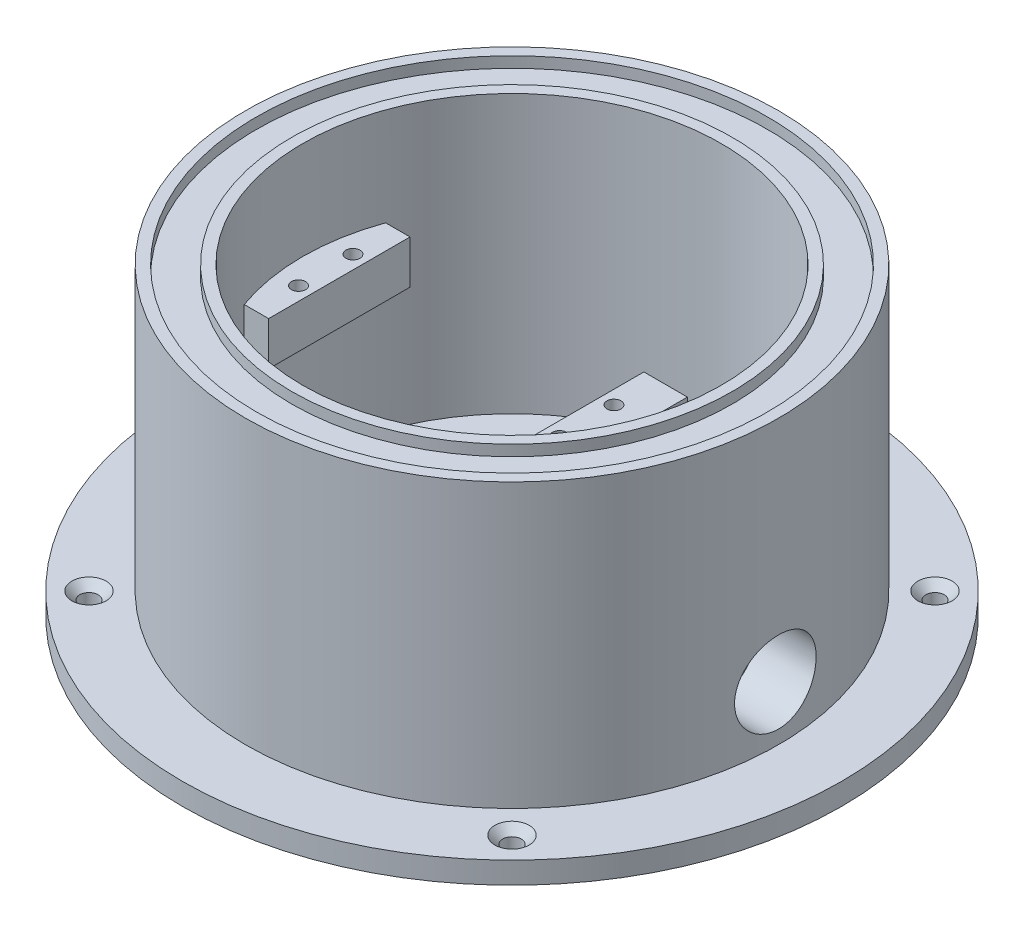
from build123d import *

# Parameters (mm, degrees)
SKETCH1_R                                    = 60.625
SKETCH1_R_2                                  = 45
BOSS_EXTRUDE1_DEPTH                          = 4
SKETCH2_R                                    = 49
SKETCH2_R_2                                  = 45
BOSS_EXTRUDE2_DEPTH                          = 52
SKETCH4_W                                    = 13.25
SKETCH4_H                                    = 8
SKETCH4_W_2                                  = 8
SKETCH4_H_2                                  = 38
BOSS_EXTRUDE4_DEPTH                          = 13
BOSS_EXTRUDE5_DEPTH                          = 4
BOSS_EXTRUDE6_REACH                          = 104.405
SKETCH18_R                                   = 45.113728165
SKETCH18_R_2                                 = 38.5
SKETCH7_R                                    = 1.3
CUT_EXTRUDE4_DEPTH                           = 7.2
SKETCH9_W                                    = 10
SKETCH9_H                                    = 24
CUT_EXTRUDE7_DEPTH                           = 8
SKETCH11_R                                   = 7.5
CUT_EXTRUDE8_DEPTH                           = 20
CUT_EXTRUDE9_DEPTH                           = 101.273532203
CSK_FOR_M3_COUNTERSUNK_FLAT_HEAD_SCR_2_COUNT = 2
CSK_FOR_M3_COUNTERSUNK_FLAT_HEAD_SCR_2_PITCH = 77.781745931
CSK_FOR_M3_COUNTERSUNK_FLAT_HEAD_SCR_3_COUNT = 2
CSK_FOR_M3_COUNTERSUNK_FLAT_HEAD_SCR_3_PITCH = 110
CSK_FOR_M3_COUNTERSUNK_FLAT_HEAD_SCR_4_COUNT = 2
CSK_FOR_M3_COUNTERSUNK_FLAT_HEAD_SCR_4_PITCH = 77.781745931
SKETCH20_R                                   = 38.708370422
BOSS_EXTRUDE7_DEPTH                          = 5
SKETCH21_R                                   = 47
SKETCH21_R_2                                 = 40.5
CUT_EXTRUDE10_DEPTH                          = 2


with BuildPart() as part:
    # Sketch1 → Boss-Extrude1 (new body)
    with BuildSketch(Plane(origin=(0, 0, 0), x_dir=(1, 0, 0), z_dir=(0, 1, 0))):
        with Locations(Location((0, 0, 0), (0, 0, 270))):
            Circle(SKETCH1_R)
        with Locations(Location((0, 0, 0), (0, 0, 270))):
            Circle(SKETCH1_R_2, mode=Mode.SUBTRACT)
    extrude(amount=BOSS_EXTRUDE1_DEPTH)

    # Sketch2 → Boss-Extrude2 (add)
    with BuildSketch(Plane(origin=(0, 4, 0), x_dir=(1, 0, 0), z_dir=(0, 1, 0))):
        with Locations(Location((0, 0, 0), (0, 0, 90))):
            Circle(SKETCH2_R)
        with Locations(Location((0, 0, 0), (0, 0, 270))):
            Circle(SKETCH2_R_2, mode=Mode.SUBTRACT)
    extrude(amount=BOSS_EXTRUDE2_DEPTH)

    # Sketch4 → Boss-Extrude4 (add, symmetric)
    with BuildSketch(Plane.XY):
        with Locations((-38.375, 34)):
            Rectangle(SKETCH4_W, SKETCH4_H)
        Polygon((-31.75, 30), (-45, 30), (-45, 16.75), align=None)
        with Locations((15.25, 19)):
            Rectangle(SKETCH4_W_2, SKETCH4_H_2)
    extrude(amount=BOSS_EXTRUDE4_DEPTH, both=True)


with BuildPart() as boss_extrude4_piece_1:
    # of the separate pieces the step leaves, piece 1, a body of its own (boss_extrude4_pieces)
    add(part.part.solids().sort_by_distance((0, 0, 60.625))[0])



with BuildPart() as boss_extrude4_piece_2:
    # of the separate pieces the step leaves, piece 2, a body of its own (boss_extrude4_pieces)
    add(part.part.solids().sort_by_distance((11.25, 38, -13))[0])


with BuildPart() as boss_extrude4_piece_1_1:
    add(boss_extrude4_piece_1.part)

    add(boss_extrude4_piece_2.part)  # Boss-Extrude5 merges Boss-Extrude4 piece 2
    # Sketch5 → Boss-Extrude5 (add)
    with BuildSketch(Plane.XZ):
        with BuildLine():
            Line((11.25, 13), (29.067400866, 34.352382842))
            ThreePointArc((29.067400866, 34.352382842), (45, 0), (29.067400866, -34.352382842))
            Line((29.067400866, -34.352382842), (11.25, -13))
            Line((11.25, -13), (11.25, 13))
        make_face()
    extrude(amount=-BOSS_EXTRUDE5_DEPTH)

    # Boss-Extrude6: up to this face of the body (flat: up to its plane)
    boss_extrude6_end = Plane(boss_extrude4_piece_1_1.part.faces().sort_by_distance((12.964733944, 0, 0))[0])
    # Sketch18 → Boss-Extrude6 (add, up to the picked face)
    with BuildSketch(Plane(origin=(0, 56, 0), x_dir=(1, 0, 0), z_dir=(0, 1, 0)), mode=Mode.PRIVATE) as boss_extrude6_sk1:
        Circle(SKETCH18_R)
        with Locations(Location((0, 0, 0), (0, 0, 270))):
            Circle(SKETCH18_R_2, mode=Mode.SUBTRACT)
    boss_extrude6_tool1 = split(extrude(boss_extrude6_sk1.sketch, amount=-BOSS_EXTRUDE6_REACH, mode=Mode.PRIVATE), bisect_by=boss_extrude6_end, keep=Keep.BOTH, mode=Mode.PRIVATE)
    add(boss_extrude6_tool1.solids().sort_by(Axis((-43.837719, 56, 0), (0, -1, 0)))[0])

    # Sketch7 → Cut-Extrude4 (cut)
    with BuildSketch(Plane(origin=(0, 38, 0), x_dir=(1, 0, 0), z_dir=(0, 1, 0))):
        with Locations(Location((-34.25, 5, 0), (0, 0, 180))):
            Circle(SKETCH7_R)
        with Locations(Location((-34.25, -5, 0), (0, 0, 180))):
            Circle(SKETCH7_R)
        with Locations(Location((13.75, 5, 0), (0, 0, 180))):
            Circle(SKETCH7_R)
        with Locations(Location((13.75, -5, 0), (0, 0, 180))):
            Circle(SKETCH7_R)
    extrude(amount=-CUT_EXTRUDE4_DEPTH, mode=Mode.SUBTRACT)

    # Sketch9 → Cut-Extrude7 (cut)
    with BuildSketch(Plane.ZY.offset(-11.25)):
        with Locations((0, 17)):
            Rectangle(SKETCH9_W, SKETCH9_H)
    extrude(amount=-CUT_EXTRUDE7_DEPTH, mode=Mode.SUBTRACT)

    # Sketch11 → Cut-Extrude8 (cut)
    with BuildSketch(Plane(origin=(49, 0, 0), x_dir=(0, 0, -1), z_dir=(1, 0, 0))):
        with Locations((0, 14)):
            Circle(SKETCH11_R)
    extrude(amount=-CUT_EXTRUDE8_DEPTH, mode=Mode.SUBTRACT)

    # Sketch12 → Cut-Extrude9 (cut, through all)
    # profile 1 of 2: a face of its own
    with BuildSketch(Plane(origin=(0, 4, 0), x_dir=(1, 0, 0), z_dir=(0, 1, 0))):
        with BuildLine():
            Line((19.25, -13), (11.25, -13))
            Line((11.25, -13), (24.902812686, -29.361538112))
            ThreePointArc((24.902812686, -29.361538112), (38.5, 0), (24.902812686, 29.361538112))
            Line((24.902812686, 29.361538112), (11.25, 13))
            Line((11.25, 13), (19.25, 13))
            Line((19.25, 13), (19.25, -13))
        make_face()
        with BuildLine():
            Line((27.25, -13.699908759), (27.25, 13.699908759))
            ThreePointArc((27.25, 13.699908759), (30.5, 0), (27.25, -13.699908759))
        make_face(mode=Mode.SUBTRACT)
    # profile 2 of 2: a face of its own
    with BuildSketch(Plane(origin=(0, 4, 0), x_dir=(1, 0, 0), z_dir=(0, 1, 0))):
        with BuildLine():
            ThreePointArc((27.25, -13.699908759), (30.5, 0), (27.25, 13.699908759))
            Line((27.25, 13.699908759), (27.25, -13.699908759))
        make_face()
    extrude(amount=-CUT_EXTRUDE9_DEPTH, mode=Mode.SUBTRACT)


with BuildPart() as cut_extrude9_piece_1:
    # of the separate pieces the step leaves, piece 1, a body of its own (cut_extrude9_pieces)
    add(boss_extrude4_piece_1_1.part.solids().sort_by_distance((0, 0, 38.5))[0])

    # Sketch17 → CSK for M3 Countersunk Flat Head Screw1 (revolve, cut)
    with BuildSketch(Plane(origin=(-38.890872965, 4, -38.890872965), x_dir=(0, 0, 1), z_dir=(1, 0, 0))):
        Polygon((0, 0), (0, 4), (1.7, 4), (1.7, 1.45), (3.15, 0), align=None)
    csk_for_m3_countersunk_flat_head_screw1 = revolve(axis=Axis((-38.890872965, 10.35, -38.890872965), (0, -1, 0)), mode=Mode.SUBTRACT)

    # CSK for M3 Countersunk Flat Head Scr 2: CSK for M3 Countersunk Flat Head Screw1 ×2
    with Locations(*[(0, 0, i * CSK_FOR_M3_COUNTERSUNK_FLAT_HEAD_SCR_2_PITCH) for i in range(1, CSK_FOR_M3_COUNTERSUNK_FLAT_HEAD_SCR_2_COUNT)]):
        add(csk_for_m3_countersunk_flat_head_screw1, mode=Mode.SUBTRACT)

    # CSK for M3 Countersunk Flat Head Scr 3: CSK for M3 Countersunk Flat Head Screw1 ×2
    with Locations(*[Vector(0.7071067811865713, 0, 0.7071067811865237) * (i * CSK_FOR_M3_COUNTERSUNK_FLAT_HEAD_SCR_3_PITCH) for i in range(1, CSK_FOR_M3_COUNTERSUNK_FLAT_HEAD_SCR_3_COUNT)]):
        add(csk_for_m3_countersunk_flat_head_screw1, mode=Mode.SUBTRACT)

    # CSK for M3 Countersunk Flat Head Scr 4: CSK for M3 Countersunk Flat Head Screw1 ×2
    with Locations(*[(i * CSK_FOR_M3_COUNTERSUNK_FLAT_HEAD_SCR_4_PITCH, 0, 0) for i in range(1, CSK_FOR_M3_COUNTERSUNK_FLAT_HEAD_SCR_4_COUNT)]):
        add(csk_for_m3_countersunk_flat_head_screw1, mode=Mode.SUBTRACT)



with BuildPart() as cut_extrude9_piece_2:
    # of the separate pieces the step leaves, piece 2, a body of its own (cut_extrude9_pieces)
    add(boss_extrude4_piece_1_1.part.solids().sort_by_distance((11.25, 38, -13))[0])


with BuildPart() as cut_extrude9_piece_1_1:
    add(cut_extrude9_piece_1.part)

    add(cut_extrude9_piece_2.part)  # Boss-Extrude7 merges Cut-Extrude9 piece 2
    # Sketch20 → Boss-Extrude7 (add)
    with BuildSketch(Plane(origin=(0, 5, 0), x_dir=(1, 0, 0), z_dir=(0, 1, 0))):
        Circle(SKETCH20_R)
    extrude(amount=-BOSS_EXTRUDE7_DEPTH)

    # Sketch21 → Cut-Extrude10 (cut)
    with BuildSketch(Plane(origin=(0, 56, 0), x_dir=(1, 0, 0), z_dir=(0, 1, 0))):
        with Locations(Location((0, 0, 0), (0, 0, 270))):
            Circle(SKETCH21_R)
        with Locations(Location((0, 0, 0), (0, 0, 270))):
            Circle(SKETCH21_R_2, mode=Mode.SUBTRACT)
    extrude(amount=-CUT_EXTRUDE10_DEPTH, mode=Mode.SUBTRACT)


solid = cut_extrude9_piece_1_1.part
